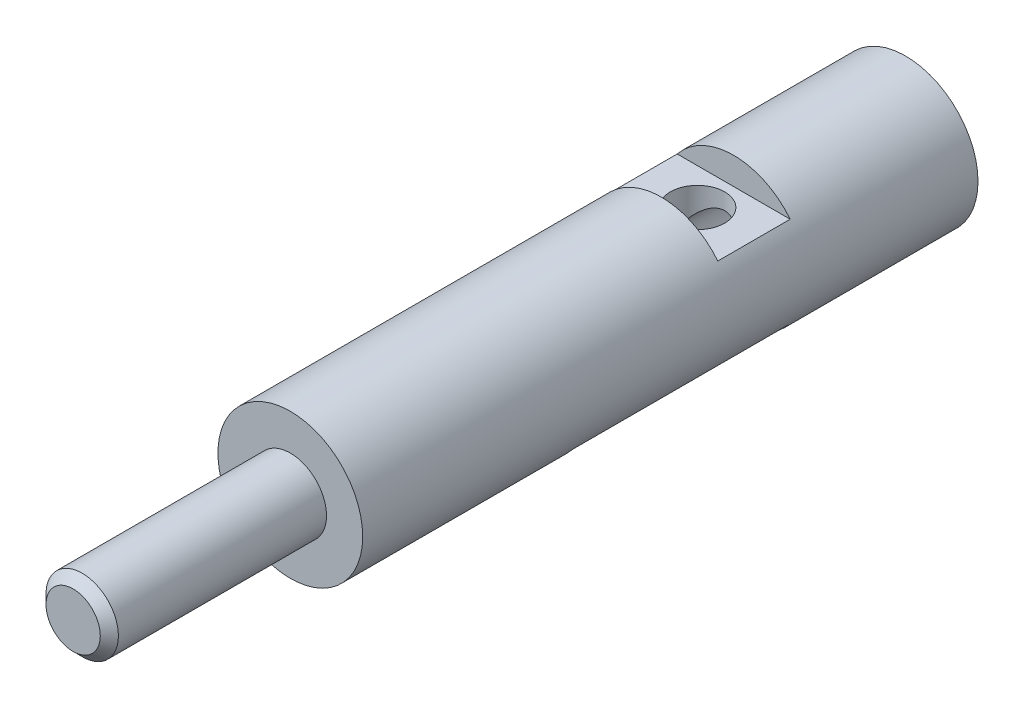
from build123d import *

# Parameters (mm, degrees)
SKETCH1_R                      = 4
BOSS_EXTRUDE1_DEPTH            = 34
SKETCH2_R                      = 2
BOSS_EXTRUDE2_DEPTH            = 12
CHAMFER1_SIZE                  = 0.5
F_3_2_3_2_DIAMETER_HOLE1_D     = 3.2
F_3_2_3_2_DIAMETER_HOLE1_DEPTH = 14
F_3_2_3_2_DIAMETER_HOLE1_TIP   = 0.96137699
CUT_EXTRUDE1_DEPTH             = 35.467375879
CUT_EXTRUDE1_DEPTH_BACK        = 35.467375879
SKETCH5_W                      = 12
SKETCH5_H                      = 1.5
SKETCH5_W_2                    = 4
F_3_0_3_DIAMETER_HOLE1_REACH   = 36.846
F_3_0_3_DIAMETER_HOLE1_BORE_R  = 1.5


with BuildPart() as part:
    # Sketch1 → Boss-Extrude1 (new body)
    with BuildSketch(Plane.XY):
        Circle(SKETCH1_R)
    extrude(amount=-BOSS_EXTRUDE1_DEPTH)

    # Sketch2 → Boss-Extrude2 (add)
    with BuildSketch(Plane.XY):
        Circle(SKETCH2_R)
    extrude(amount=BOSS_EXTRUDE2_DEPTH)

    # Chamfer1
    chamfer1_edges = [part.edges().sort_by_distance(p)[0] for p in [
        (-2, 0, 12),
    ]]
    chamfer(chamfer1_edges, length=CHAMFER1_SIZE)

    # Ø3.2 (3.2) Diameter Hole1
    with Locations(Plane(origin=(0, 0, -34), x_dir=(-1, 0, 0), z_dir=(0, 0, -1))):
        with Locations((0, 0)):
            Hole(F_3_2_3_2_DIAMETER_HOLE1_D / 2, depth=F_3_2_3_2_DIAMETER_HOLE1_DEPTH)
            with Locations((0, 0, -(F_3_2_3_2_DIAMETER_HOLE1_DEPTH + F_3_2_3_2_DIAMETER_HOLE1_TIP / 2))):  # 118° drill point
                Cone(0, F_3_2_3_2_DIAMETER_HOLE1_D / 2, F_3_2_3_2_DIAMETER_HOLE1_TIP, mode=Mode.SUBTRACT)

    # Sketch5 → Cut-Extrude1 (cut, two sides: drawn at the far end of the back side and taken through both)
    with BuildSketch(Plane(origin=(0, 0, 0), x_dir=(0, 0, -1), z_dir=(1, 0, 0)).offset(-CUT_EXTRUDE1_DEPTH_BACK)):
        with Locations((18.5, -3.25)):
            Rectangle(SKETCH5_W, SKETCH5_H)
        with Locations((22.5, 3.25)):
            Rectangle(SKETCH5_W_2, SKETCH5_H)
    extrude(amount=CUT_EXTRUDE1_DEPTH + CUT_EXTRUDE1_DEPTH_BACK, mode=Mode.SUBTRACT)

    # Ø3.0 (3) Diameter Hole1 bore → Ø3.0 (3) Diameter Hole1 (cut, up to next)
    with BuildSketch(Plane(origin=(0, 2.5, 0), x_dir=(1, 0, 0), z_dir=(0, 1, 0)), mode=Mode.PRIVATE) as f_3_0_3_diameter_hole1_sk1:
        with Locations((0, 22.5)):
            Circle(F_3_0_3_DIAMETER_HOLE1_BORE_R)
    f_3_0_3_diameter_hole1_tool1 = extrude(f_3_0_3_diameter_hole1_sk1.sketch, amount=-F_3_0_3_DIAMETER_HOLE1_REACH, mode=Mode.PRIVATE) & part.part
    add(f_3_0_3_diameter_hole1_tool1.solids().sort_by_distance((0, 2.5, -22.5))[0], mode=Mode.SUBTRACT)


solid = part.part
